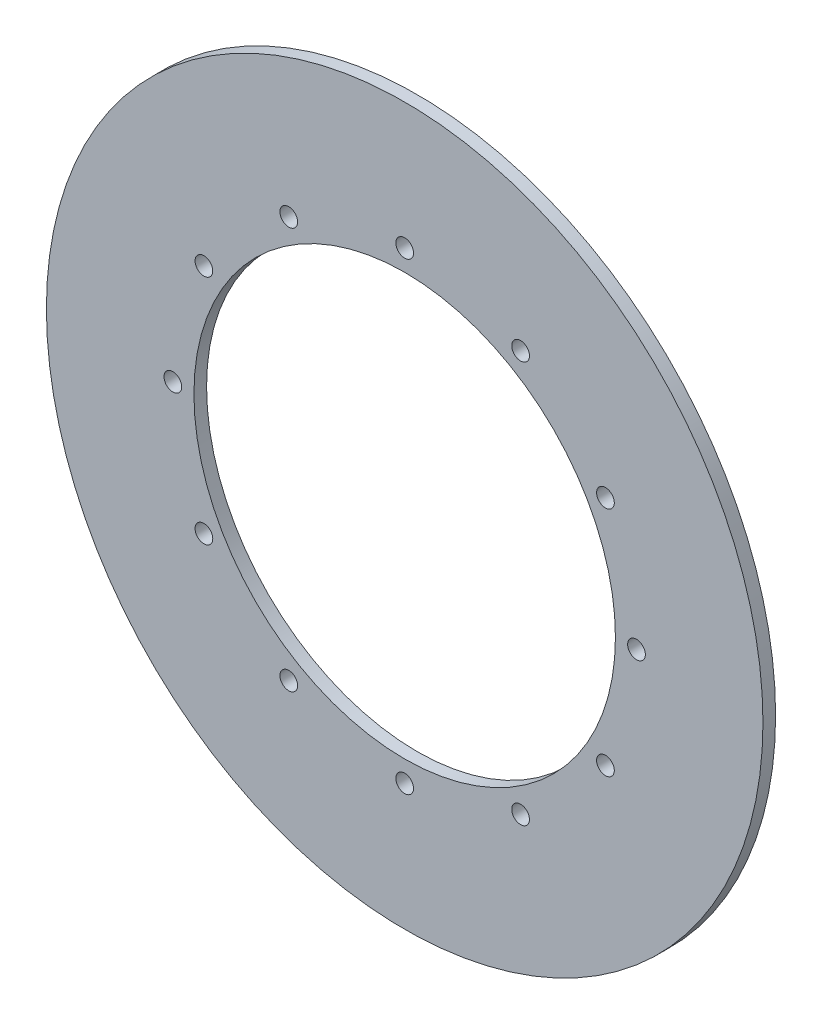
from build123d import *

# Parameters (mm, degrees)
SKETCH_1_R      = 85
SKETCH_1_R_2    = 50
SKETCH_1_R_3    = 2.1
EXTRUDE_1_DEPTH = 3


with BuildPart() as part:
    # 草图1 → 凸台-拉伸1 (new body)
    with BuildSketch(Plane.XY):
        Circle(SKETCH_1_R)
        Circle(SKETCH_1_R_2, mode=Mode.SUBTRACT)
        with Locations((0, 55)):
            Circle(SKETCH_1_R_3, mode=Mode.SUBTRACT)
        with Locations((27.5, 47.631397208)):
            Circle(SKETCH_1_R_3, mode=Mode.SUBTRACT)
        with Locations((47.631397208, 27.5)):
            Circle(SKETCH_1_R_3, mode=Mode.SUBTRACT)
        with Locations((55, 0)):
            Circle(SKETCH_1_R_3, mode=Mode.SUBTRACT)
        with Locations((47.631397208, -27.5)):
            Circle(SKETCH_1_R_3, mode=Mode.SUBTRACT)
        with Locations((27.5, -47.631397208)):
            Circle(SKETCH_1_R_3, mode=Mode.SUBTRACT)
        with Locations((0, -55)):
            Circle(SKETCH_1_R_3, mode=Mode.SUBTRACT)
        with Locations((-27.5, -47.631397208)):
            Circle(SKETCH_1_R_3, mode=Mode.SUBTRACT)
        with Locations((-47.631397208, -27.5)):
            Circle(SKETCH_1_R_3, mode=Mode.SUBTRACT)
        with Locations((-55, 0)):
            Circle(SKETCH_1_R_3, mode=Mode.SUBTRACT)
        with Locations((-47.631397208, 27.5)):
            Circle(SKETCH_1_R_3, mode=Mode.SUBTRACT)
        with Locations((-27.5, 47.631397208)):
            Circle(SKETCH_1_R_3, mode=Mode.SUBTRACT)
    extrude(amount=EXTRUDE_1_DEPTH)


solid = part.part
